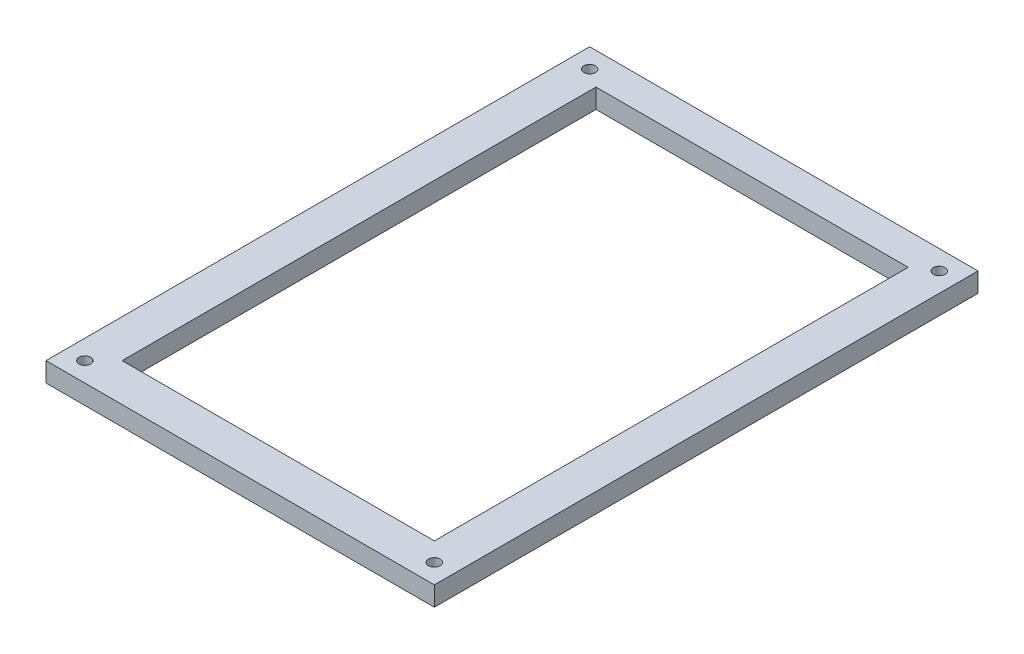
from build123d import *

# Parameters (mm, degrees)
SKETCH1_W           = 127
SKETCH1_H           = 177.8
BOSS_EXTRUDE1_DEPTH = 6.35
SKETCH2_W           = 102.108
SKETCH2_H           = 154.965684877
CUT_EXTRUDE1_DEPTH  = 219.591313871
SKETCH3_R           = 1.905
CUT_EXTRUDE2_DEPTH  = 219.591313871


with BuildPart() as part:
    # Sketch1 → Boss-Extrude1 (new body)
    with BuildSketch(Plane(origin=(0, 0, 0), x_dir=(1, 0, 0), z_dir=(0, 1, 0))):
        with Locations((63.5, 88.9)):
            Rectangle(SKETCH1_W, SKETCH1_H)
    extrude(amount=BOSS_EXTRUDE1_DEPTH)

    # Sketch2 → Cut-Extrude1 (cut, through all)
    with BuildSketch(Plane(origin=(0, 6.35, 0), x_dir=(1, 0, 0), z_dir=(0, 1, 0))):
        with Locations((63.5, 89.928842438)):
            Rectangle(SKETCH2_W, SKETCH2_H)
    extrude(amount=-CUT_EXTRUDE1_DEPTH, mode=Mode.SUBTRACT)

    # Sketch3 → Cut-Extrude2 (cut, through all)
    with BuildSketch(Plane(origin=(0, 6.35, 0), x_dir=(1, 0, 0), z_dir=(0, 1, 0))):
        with Locations(Location((6.35, 171.45, 0), (0, 0, 270))):
            Circle(SKETCH3_R)
        with Locations(Location((6.35, 6.35, 0), (0, 0, 90))):
            Circle(SKETCH3_R)
        with Locations(Location((120.65, 6.35, 0), (0, 0, 270))):
            Circle(SKETCH3_R)
        with Locations(Location((120.65, 171.45, 0), (0, 0, 90))):
            Circle(SKETCH3_R)
    extrude(amount=-CUT_EXTRUDE2_DEPTH, mode=Mode.SUBTRACT)


solid = part.part
